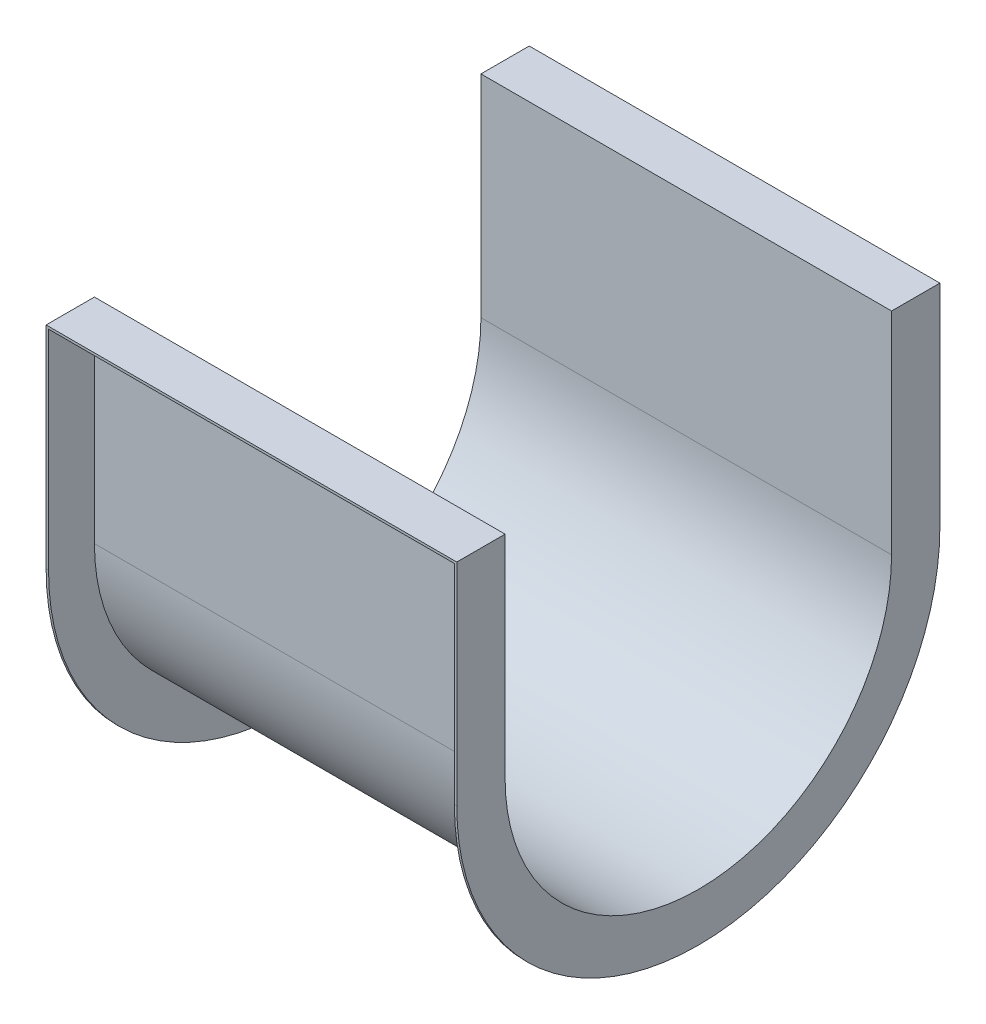
from build123d import *

# Parameters (mm, degrees)
SALIENTE_EXTRUIR1_DEPTH = 170
CROQUIS2_W              = 170
CROQUIS2_H              = 20.000000000000014
SALIENTE_EXTRUIR2_DEPTH = 3.7
VACIADO1_T              = -1


with BuildPart() as part:
    # Croquis1 → Saliente-Extruir1 (new body)
    with BuildSketch(Plane(origin=(0, 0, 0), x_dir=(0, 0, -1), z_dir=(1, 0, 0))):
        with BuildLine():
            Line((80, 0), (100, 0))
            Line((100, 0), (99.99999999999999, -83.7))
            ThreePointArc((99.99999999999999, -83.7), (70.71067811865474, -154.41067811865474), (1.125e-14, -183.7))
            ThreePointArc((1.125e-14, -183.7), (-70.71067811865473, -154.41067811865474), (-99.99999999999999, -83.70000000000002))
            Line((-99.99999999999999, -83.70000000000002), (-100, -1.225e-14))
            Line((-100, -1.225e-14), (-80, -9.8e-15))
            Line((-80, -9.8e-15), (-79.99999999999999, -83.70000000000002))
            ThreePointArc((-79.99999999999999, -83.70000000000002), (-56.568542494923804, -140.26854249492382), (-1.47e-14, -163.70000000000002))
            ThreePointArc((-1.47e-14, -163.70000000000002), (56.5685424949238, -140.26854249492382), (80, -83.70000000000002))
            Line((80, -83.70000000000002), (80, 0))
        make_face()
    extrude(amount=SALIENTE_EXTRUIR1_DEPTH)

    # Croquis2 → Saliente-Extruir2 (add)
    with BuildSketch(Plane(origin=(0, 0, 0), x_dir=(1, 0, 0), z_dir=(0, 1, 0))):
        with Locations((85, 90)):
            Rectangle(CROQUIS2_W, CROQUIS2_H)
        with Locations((85, -90)):
            Rectangle(CROQUIS2_W, CROQUIS2_H)
    extrude(amount=SALIENTE_EXTRUIR2_DEPTH)

    # Vaciado1
    vaciado1_openings = [part.faces().sort_by_distance(p)[0] for p in [
        (85, -183.7, 0),
        (85, -40, 100),
        (85, -40, -100),
    ]]
    offset(amount=VACIADO1_T, openings=vaciado1_openings, kind=Kind.INTERSECTION)


solid = part.part
